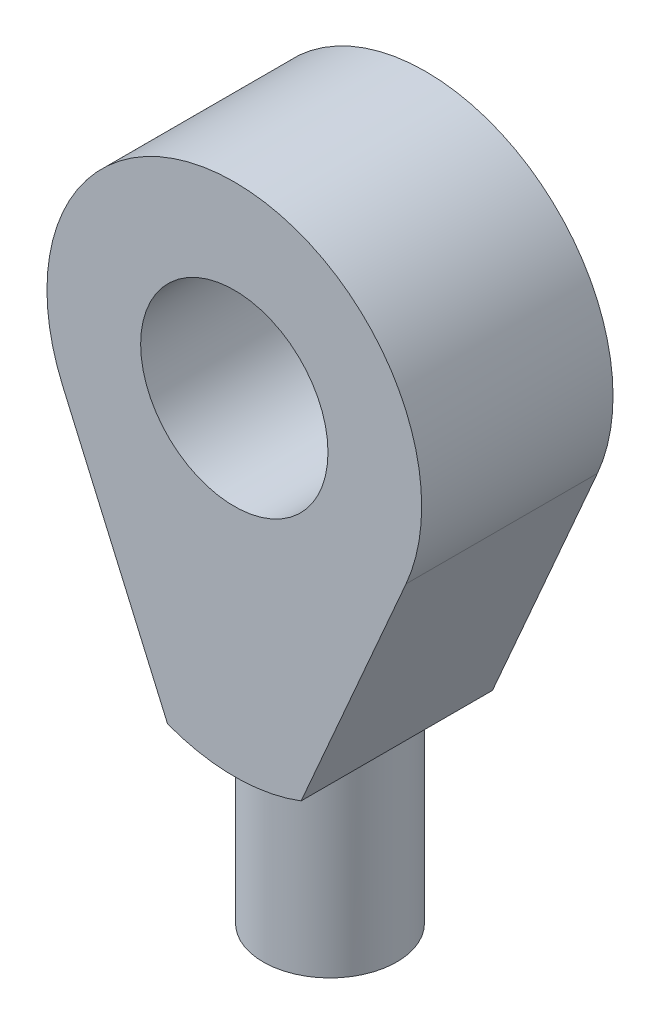
from build123d import *

# Parameters (mm, degrees)
SKETCH1_R           = 2.5
BOSS_EXTRUDE1_DEPTH = 2.5535
SKETCH2_W           = 0.783
SKETCH2_H           = 5


with BuildPart() as part:
    # Sketch1 → Boss-Extrude1 (new, symmetric)
    with BuildSketch(Plane.XY):
        with BuildLine():
            Line((-4.582575695, -2), (-1.782575695, -8.415605973))
            ThreePointArc((-1.782575695, -8.415605973), (0, -8.744158243), (1.782575695, -8.415605973))
            Line((1.782575695, -8.415605973), (4.582575695, -2))
            ThreePointArc((4.582575695, -2), (0, 5), (-4.582575695, -2))
        make_face()
        with Locations(Location((0, 0, 0), (0, 0, 180))):
            Circle(SKETCH1_R, mode=Mode.SUBTRACT)
    extrude(amount=BOSS_EXTRUDE1_DEPTH, both=True)

    # Sketch2 → Revolve1 (revolve)
    with BuildSketch(Plane.XY, mode=Mode.PRIVATE) as revolve1_sk:
        with Locations((1.3915, -10.916)):
            Rectangle(SKETCH2_W, SKETCH2_H)
    revolve(revolve1_sk.sketch.rotate(Axis((0, -8.744158243, 0), (0, -1, 0)), 180), axis=Axis((0, -8.744158243, 0), (0, -1, 0)))


solid = part.part
